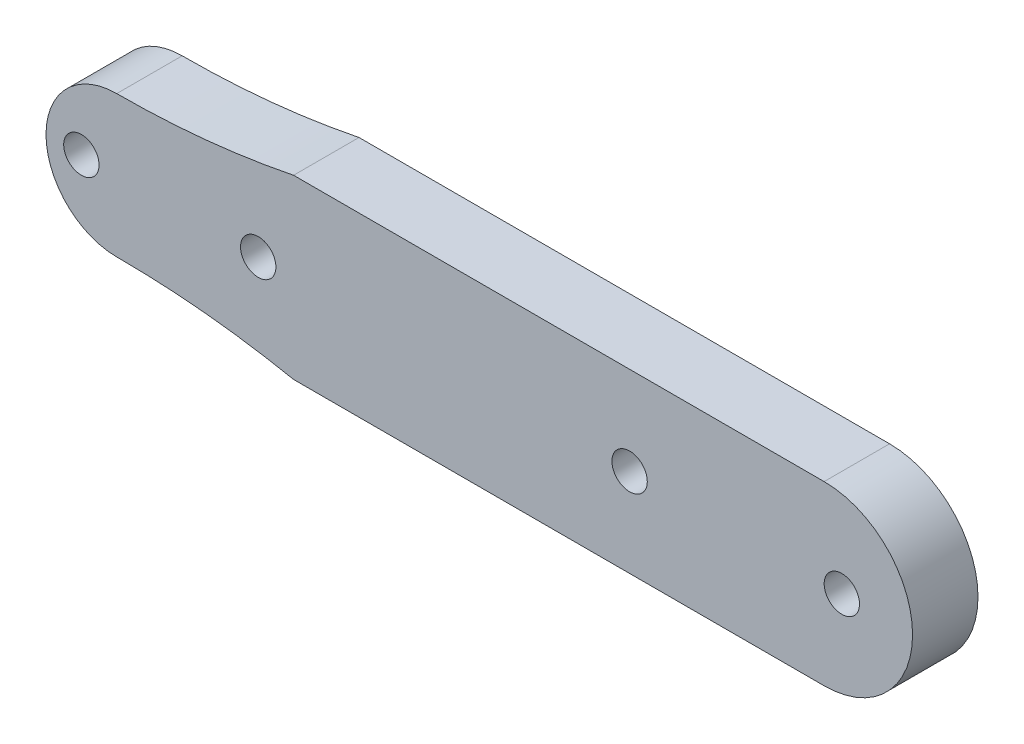
from build123d import *

# Parameters (mm, degrees)
SKETCH1_R           = 1
BOSS_EXTRUDE1_DEPTH = 3.7


with BuildPart() as part:
    # Sketch1 → Boss-Extrude1 (new body)
    with BuildSketch(Plane.XY):
        with BuildLine():
            Line((0, 5), (30, 5))
            ThreePointArc((30, 5), (35, 0), (30, -5))
            Line((30, -5), (0, -5))
            ThreePointArc((0, -5), (-4.975062189, -4.250621894), (-10, -4))
            ThreePointArc((-10, -4), (-14, 0), (-10, 4))
            ThreePointArc((-10, 4), (-4.975062189, 4.250621894), (0, 5))
        make_face()
        with Locations((-12, 0)):
            Circle(SKETCH1_R, mode=Mode.SUBTRACT)
        with Locations((-2, 0)):
            Circle(SKETCH1_R, mode=Mode.SUBTRACT)
        with Locations((19, 0)):
            Circle(SKETCH1_R, mode=Mode.SUBTRACT)
        with Locations((31, 0)):
            Circle(SKETCH1_R, mode=Mode.SUBTRACT)
    extrude(amount=BOSS_EXTRUDE1_DEPTH)


solid = part.part
